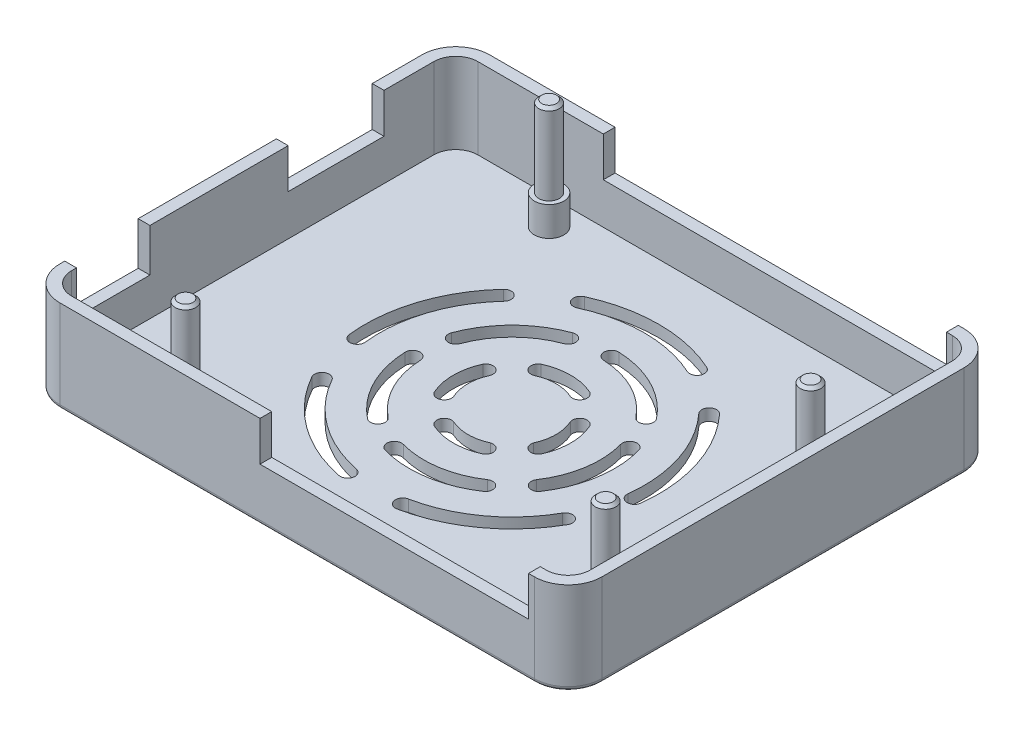
from build123d import *

# Parameters (mm, degrees)
SKETCH1_W             = 73.8
SKETCH1_H             = 58.5
BOSS_EXTRUDE1_DEPTH   = 12.6
SKETCH2_W             = 70.6
SKETCH2_H             = 55.3
CUT_EXTRUDE1_DEPTH    = 11
CUT_EXTRUDE2_REACH    = 95.232
SKETCH3_W             = 13.04
SKETCH3_H             = 5.42
CUT_EXTRUDE3_REACH    = 95.232
SKETCH4_W             = 10
SKETCH4_H             = 5.85
FILLET1_R             = 4.6
CHAMFER1_SIZE         = 0.4
FILLET2_R             = 0.6
FILLET3_R             = 3
CUT_EXTRUDE4_DEPTH    = 10
ESBO_O1_W             = 36.56
ESBO_O1_H             = 5.4
CORTE_EXTRUS_O1_DEPTH = 6
ESBO_O2_W             = 46.72
ESBO_O2_H             = 5.4
CORTE_EXTRUS_O2_DEPTH = 6


with BuildPart() as part:
    # Sketch1 → Boss-Extrude1 (new body)
    with BuildSketch(Plane(origin=(0, 11, 0), x_dir=(1, 0, 0), z_dir=(0, 1, 0))):
        with Locations((34.3, 26.65)):
            Rectangle(SKETCH1_W, SKETCH1_H)
    extrude(amount=-BOSS_EXTRUDE1_DEPTH)

    # Sketch2 → Cut-Extrude1 (cut)
    with BuildSketch(Plane(origin=(0, 11, 0), x_dir=(-1, 0, 0), z_dir=(0, 1, 0))):
        with Locations((-34.3, -26.65)):
            Rectangle(SKETCH2_W, SKETCH2_H)
    extrude(amount=-CUT_EXTRUDE1_DEPTH, mode=Mode.SUBTRACT)

    # Sketch3 → Cut-Extrude2 (cut, up to next)
    with BuildSketch(Plane.ZY.offset(2.6), mode=Mode.PRIVATE) as cut_extrude2_sk1:
        with Locations((-38, 8.29)):
            Rectangle(SKETCH3_W, SKETCH3_H)
    cut_extrude2_tool1 = extrude(cut_extrude2_sk1.sketch, amount=-CUT_EXTRUDE2_REACH, mode=Mode.PRIVATE) & part.part
    add(cut_extrude2_tool1.solids().sort_by_distance((-2.6, 8.29, -38))[0], mode=Mode.SUBTRACT)

    # Sketch4 → Cut-Extrude3 (cut, up to next)
    with BuildSketch(Plane.ZY.offset(2.6), mode=Mode.PRIVATE) as cut_extrude3_sk1:
        with Locations((-7.655, 8.075)):
            Rectangle(SKETCH4_W, SKETCH4_H)
    cut_extrude3_tool1 = extrude(cut_extrude3_sk1.sketch, amount=-CUT_EXTRUDE3_REACH, mode=Mode.PRIVATE) & part.part
    add(cut_extrude3_tool1.solids().sort_by_distance((-2.6, 8.075, -7.655))[0], mode=Mode.SUBTRACT)

    # Sketch5 → Revolve1 (revolve)
    with BuildSketch(Plane(origin=(0, 0, -50.7), x_dir=(-1, 0, 0), z_dir=(0, 0, -1)), mode=Mode.PRIVATE) as revolve1_sk:
        Polygon((-17.3, 0), (-15.3, 0), (-15.3, 15), (-16.7, 15), (-16.7, 4), (-17.3, 4), align=None)
    revolve(revolve1_sk.sketch.rotate(Axis((15.3, 0, -50.7), (0, 1, 0)), 270), axis=Axis((15.3, 0, -50.7), (0, 1, 0)))

    # Sketch6 → Revolve2 (revolve)
    with BuildSketch(Plane(origin=(0, 0, -35.5), x_dir=(-1, 0, 0), z_dir=(0, 0, -1)), mode=Mode.PRIVATE) as revolve2_sk:
        Polygon((-68.1, 0), (-66.1, 0), (-66.1, 15), (-67.5, 15), (-67.5, 4), (-68.1, 4), align=None)
    revolve(revolve2_sk.sketch.rotate(Axis((66.1, 0, -35.5), (0, 1, 0)), 270), axis=Axis((66.1, 0, -35.5), (0, 1, 0)))

    # Sketch7 → Revolve3 (revolve)
    with BuildSketch(Plane(origin=(0, 0, -2.5), x_dir=(-1, 0, 0), z_dir=(0, 0, -1)), mode=Mode.PRIVATE) as revolve3_sk:
        Polygon((-16, 0), (-14, 0), (-14, 15), (-15.4, 15), (-15.4, 4), (-16, 4), align=None)
    revolve(revolve3_sk.sketch.rotate(Axis((14, 0, -2.5), (0, 1, 0)), 270), axis=Axis((14, 0, -2.5), (0, 1, 0)))

    # Sketch8 → Revolve4 (revolve)
    with BuildSketch(Plane(origin=(0, 0, -7.6), x_dir=(-1, 0, 0), z_dir=(0, 0, -1)), mode=Mode.PRIVATE) as revolve4_sk:
        Polygon((-68.1, 0), (-66.1, 0), (-66.1, 15), (-67.5, 15), (-67.5, 4), (-68.1, 4), align=None)
    revolve(revolve4_sk.sketch.rotate(Axis((66.1, 0, -7.6), (0, 1, 0)), 270), axis=Axis((66.1, 0, -7.6), (0, 1, 0)))

    # Fillet1
    fillet1_edges = [part.edges().sort_by_distance(p)[0] for p in [
        (71.2, 4.7, -55.9),
        (71.2, 4.7, 2.6),
        (-2.6, 4.7, 2.6),
        (-2.6, 4.7, -55.9),
    ]]
    fillet(fillet1_edges, radius=FILLET1_R)

    # Chamfer1
    chamfer1_edges = [part.edges().sort_by_distance(p)[0] for p in [
        (15.3, 15, -52.1),
        (66.1, 15, -36.9),
        (14, 15, -3.9),
        (66.1, 15, -9),
    ]]
    chamfer(chamfer1_edges, length=CHAMFER1_SIZE)

    # Fillet2
    fillet2_edges = [part.edges().sort_by_distance(p)[0] for p in [
        (-2.6, -1.6, -26.65),
        (34.3, -1.6, 2.6),
        (34.3, -1.6, -55.9),
        (71.2, -1.6, -26.65),
        (69.852691193, -1.6, -54.552691193),
        (69.852691193, -1.6, 1.252691193),
        (-1.252691193, -1.6, -54.552691193),
        (-1.252691193, -1.6, 1.252691193),
    ]]
    fillet(fillet2_edges, radius=FILLET2_R)

    # Fillet3
    fillet3_edges = [part.edges().sort_by_distance(p)[0] for p in [
        (-1, 5.5, 1),
        (-1, 5.5, -54.3),
        (69.6, 5.5, -54.3),
        (69.6, 5.5, 1),
    ]]
    fillet(fillet3_edges, radius=FILLET3_R)

    # Sketch9 → Cut-Extrude4 (cut)
    with BuildSketch(Plane(origin=(0, 0, 0), x_dir=(1, 0, 0), z_dir=(0, 1, 0))):
        with BuildLine():
            ThreePointArc((36.8, 32.104356057), (38.037646256, 32.652499518), (37.605381076, 33.93522175))
            ThreePointArc((37.605381076, 33.93522175), (37.521239295, 33.972814855), (37.43667004, 34.009436192))
            ThreePointArc((37.43667004, 34.009436192), (34.3, 34.65), (31.16332996, 34.009436192))
            ThreePointArc((31.16332996, 34.009436192), (31.078760705, 33.972814855), (30.994618924, 33.93522175))
            ThreePointArc((30.994618924, 33.93522175), (30.562353744, 32.652499518), (31.8, 32.104356057))
            ThreePointArc((31.8, 32.104356057), (34.3, 32.65), (36.8, 32.104356057))
        make_face()
        with BuildLine():
            ThreePointArc((28.845643943, 24.15), (28.3, 26.65), (28.845643943, 29.15))
            ThreePointArc((28.845643943, 29.15), (28.297500482, 30.387646256), (27.01477825, 29.955381076))
            ThreePointArc((27.01477825, 29.955381076), (26.977185145, 29.871239295), (26.940563808, 29.78667004))
            ThreePointArc((26.940563808, 29.78667004), (26.3, 26.65), (26.940563808, 23.51332996))
            ThreePointArc((26.940563808, 23.51332996), (26.977185145, 23.428760705), (27.01477825, 23.344618924))
            ThreePointArc((27.01477825, 23.344618924), (28.297500482, 22.912353744), (28.845643943, 24.15))
        make_face()
        with BuildLine():
            ThreePointArc((37.43667004, 19.290563808), (37.521239295, 19.327185145), (37.605381076, 19.36477825))
            ThreePointArc((37.605381076, 19.36477825), (38.037646256, 20.647500482), (36.8, 21.195643943))
            ThreePointArc((36.8, 21.195643943), (34.3, 20.65), (31.8, 21.195643943))
            ThreePointArc((31.8, 21.195643943), (30.562353744, 20.647500482), (30.994618924, 19.36477825))
            ThreePointArc((30.994618924, 19.36477825), (31.078760705, 19.327185145), (31.16332996, 19.290563808))
            ThreePointArc((31.16332996, 19.290563808), (34.3, 18.65), (37.43667004, 19.290563808))
        make_face()
        with BuildLine():
            ThreePointArc((41.659436192, 23.51332996), (42.138223317, 25.049295395), (42.3, 26.65))
            ThreePointArc((42.3, 26.65), (42.138223317, 28.250704605), (41.659436192, 29.78667004))
            ThreePointArc((41.659436192, 29.78667004), (41.622814855, 29.871239295), (41.58522175, 29.955381076))
            ThreePointArc((41.58522175, 29.955381076), (40.302499518, 30.387646256), (39.754356057, 29.15))
            ThreePointArc((39.754356057, 29.15), (40.162002062, 27.929426367), (40.3, 26.65))
            ThreePointArc((40.3, 26.65), (40.162002062, 25.370573633), (39.754356057, 24.15))
            ThreePointArc((39.754356057, 24.15), (40.302499518, 22.912353744), (41.58522175, 23.344618924))
            ThreePointArc((41.58522175, 23.344618924), (41.622814855, 23.428760705), (41.659436192, 23.51332996))
        make_face()
        with BuildLine():
            ThreePointArc((45.957608015, 18.897569712), (47.701613937, 22.600710693), (48.3, 26.65))
            ThreePointArc((48.3, 26.65), (48.170066237, 28.55296153), (47.782676774, 30.420600352))
            ThreePointArc((47.782676774, 30.420600352), (46.550299836, 31.114320097), (45.856580092, 29.881943159))
            ThreePointArc((45.856580092, 29.881943159), (46.188628203, 28.281109883), (46.3, 26.65))
            ThreePointArc((46.3, 26.65), (45.78709766, 23.179180594), (44.292235441, 20.005059753))
            ThreePointArc((44.292235441, 20.005059753), (44.571176708, 18.618628446), (45.957608015, 18.897569712))
        make_face()
        with BuildLine():
            ThreePointArc((30.529399648, 13.167323226), (36.490082511, 12.822363232), (42.052430288, 14.992391985))
            ThreePointArc((42.052430288, 14.992391985), (42.331371554, 16.378823292), (40.944940247, 16.657764559))
            ThreePointArc((40.944940247, 16.657764559), (36.17721358, 14.797739913), (31.068056841, 15.093419908))
            ThreePointArc((31.068056841, 15.093419908), (29.835679903, 14.399700164), (30.529399648, 13.167323226))
        make_face()
        with BuildLine():
            ThreePointArc((30.121909596, 37.899158216), (30.711165247, 39.184762268), (29.425561195, 39.774017919))
            ThreePointArc((29.425561195, 39.774017919), (24.400505063, 36.549494937), (21.175982081, 31.524438805))
            ThreePointArc((21.175982081, 31.524438805), (21.765237732, 30.238834753), (23.050841784, 30.828090404))
            ThreePointArc((23.050841784, 30.828090404), (25.814718626, 35.135281374), (30.121909596, 37.899158216))
        make_face()
        with BuildLine():
            ThreePointArc((43.707484285, 34.099781166), (45.112256406, 33.936639239), (45.275398333, 35.34141136))
            ThreePointArc((45.275398333, 35.34141136), (40.655866996, 39.124091339), (34.880322217, 40.637967191))
            ThreePointArc((34.880322217, 40.637967191), (33.839730117, 39.680278264), (34.797419043, 38.639686163))
            ThreePointArc((34.797419043, 38.639686163), (39.747885997, 37.34207829), (43.707484285, 34.099781166))
        make_face()
        with BuildLine():
            ThreePointArc((41.8, 43.013068172), (43.12572601, 43.505460848), (42.633333333, 44.831186858))
            ThreePointArc((42.633333333, 44.831186858), (34.3, 46.65), (25.966666667, 44.831186858))
            ThreePointArc((25.966666667, 44.831186858), (25.47427399, 43.505460848), (26.8, 43.013068172))
            ThreePointArc((26.8, 43.013068172), (34.3, 44.65), (41.8, 43.013068172))
        make_face()
        with BuildLine():
            ThreePointArc((16.871558209, 16.83932129), (22.544294954, 10.469660113), (30.355174782, 7.042900418))
            ThreePointArc((30.355174782, 7.042900418), (31.532771022, 7.826014137), (30.749657304, 9.003610377))
            ThreePointArc((30.749657304, 9.003610377), (23.719865459, 12.087694101), (18.614402388, 17.820389161))
            ThreePointArc((18.614402388, 17.820389161), (17.252446363, 18.201277315), (16.871558209, 16.83932129))
        make_face()
        with BuildLine():
            ThreePointArc((38.244825218, 7.042900418), (46.055705046, 10.469660113), (51.728441791, 16.83932129))
            ThreePointArc((51.728441791, 16.83932129), (51.347553637, 18.201277315), (49.985597612, 17.820389161))
            ThreePointArc((49.985597612, 17.820389161), (44.880134541, 12.087694101), (37.850342696, 9.003610377))
            ThreePointArc((37.850342696, 9.003610377), (37.067228978, 7.826014137), (38.244825218, 7.042900418))
        make_face()
        with BuildLine():
            ThreePointArc((54.166477855, 24.342824748), (54.266591561, 25.494482172), (54.3, 26.65))
            ThreePointArc((54.3, 26.65), (52.932282366, 33.918978872), (49.016194615, 40.193766686))
            ThreePointArc((49.016194615, 40.193766686), (47.60319655, 40.252388083), (47.544575154, 38.839390017))
            ThreePointArc((47.544575154, 38.839390017), (51.069054129, 33.192080985), (52.3, 26.65))
            ThreePointArc((52.3, 26.65), (52.269932405, 25.610033954), (52.179830069, 24.573542273))
            ThreePointArc((52.179830069, 24.573542273), (53.057795199, 23.464859618), (54.166477855, 24.342824748))
        make_face()
        with BuildLine():
            ThreePointArc((21.055424846, 38.839390017), (20.99680345, 40.252388083), (19.583805385, 40.193766686))
            ThreePointArc((19.583805385, 40.193766686), (15.278869674, 32.830339887), (14.433522145, 24.342824748))
            ThreePointArc((14.433522145, 24.342824748), (15.542204801, 23.464859618), (16.420169931, 24.573542273))
            ThreePointArc((16.420169931, 24.573542273), (17.180982707, 32.212305899), (21.055424846, 38.839390017))
        make_face()
        with BuildLine():
            ThreePointArc((20.312032809, 26.069677783), (21.825908661, 20.294133004), (25.60858864, 15.674601667))
            ThreePointArc((25.60858864, 15.674601667), (27.013360761, 15.837743594), (26.850218834, 17.242515715))
            ThreePointArc((26.850218834, 17.242515715), (23.60792171, 21.202114003), (22.310313837, 26.152580957))
            ThreePointArc((22.310313837, 26.152580957), (21.269721736, 27.110269883), (20.312032809, 26.069677783))
        make_face()
    extrude(amount=-CUT_EXTRUDE4_DEPTH, mode=Mode.SUBTRACT)

    # Esboço1 → Corte-extrusão1 (cut)
    with BuildSketch(Plane.XY.offset(2.6)):
        with Locations((47.52, 8.3)):
            Rectangle(ESBO_O1_W, ESBO_O1_H)
    extrude(amount=-CORTE_EXTRUS_O1_DEPTH, mode=Mode.SUBTRACT)

    # Esboço2 → Corte-extrusão2 (cut)
    with BuildSketch(Plane(origin=(0, 0, -55.9), x_dir=(-1, 0, 0), z_dir=(0, 0, -1))):
        with Locations((-42.44, 8.3)):
            Rectangle(ESBO_O2_W, ESBO_O2_H)
    extrude(amount=-CORTE_EXTRUS_O2_DEPTH, mode=Mode.SUBTRACT)


solid = part.part
